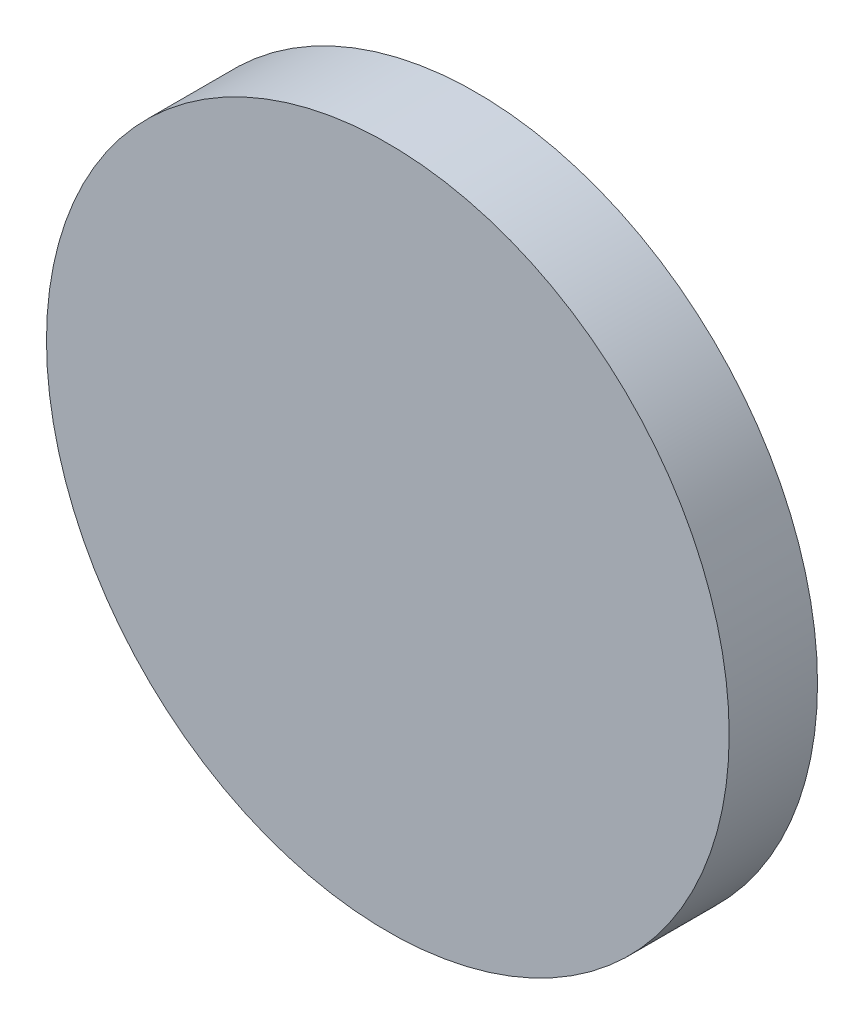
from build123d import *

# Parameters (mm, degrees)
SKETCH1_R           = 80
BOSS_EXTRUDE1_DEPTH = 20.7


with BuildPart() as part:
    # Sketch1 → Boss-Extrude1 (new body)
    with BuildSketch(Plane.XY):
        Circle(SKETCH1_R)
    extrude(amount=BOSS_EXTRUDE1_DEPTH)


solid = part.part
